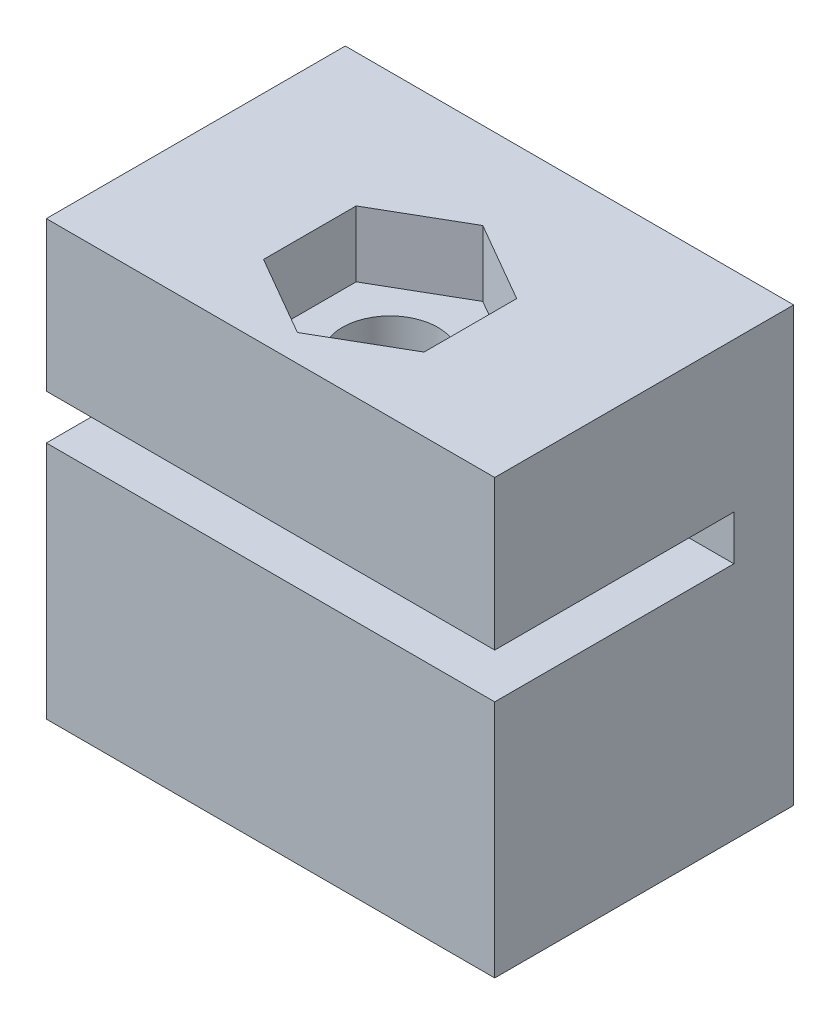
from build123d import *

# Parameters (mm, degrees)
SKETCH1_W    = 15
SKETCH1_H    = 10
BASE_DEPTH   = 8
SPACER_DEPTH = 1.5
SKETCH4_W    = 15
SKETCH4_H    = 10
TOP_DEPTH    = 5
SKETCH5_R    = 1.6
BORE_DEPTH   = 18.073371079
NUT_DEPTH    = 2.2


with BuildPart() as part:
    # Sketch1 → base (new body)
    with BuildSketch(Plane(origin=(0, 0, 0), x_dir=(1, 0, 0), z_dir=(0, 1, 0))):
        Rectangle(SKETCH1_W, SKETCH1_H)
    extrude(amount=BASE_DEPTH)

    # Sketch3 → spacer (add)
    with BuildSketch(Plane(origin=(0, 8, 0), x_dir=(1, 0, 0), z_dir=(0, 1, 0))):
        Polygon((-7.5, 3), (-5.99621099, 3), (5.99621099, 3), (7.5, 3), (7.5, 5), (-7.5, 5), align=None)
    extrude(amount=SPACER_DEPTH)

    # Sketch4 → top (add)
    with BuildSketch(Plane(origin=(0, 9.5, 0), x_dir=(1, 0, 0), z_dir=(0, 1, 0))):
        Rectangle(SKETCH4_W, SKETCH4_H)
    extrude(amount=TOP_DEPTH)

    # Sketch5 → bore (cut, through all)
    with BuildSketch(Plane(origin=(0, 14.5, 0), x_dir=(1, 0, 0), z_dir=(0, 1, 0))):
        with Locations(Location((0, -1, 0), (0, 0, 270))):
            Circle(SKETCH5_R)
    extrude(amount=-BORE_DEPTH, mode=Mode.SUBTRACT)

    # Sketch6 → nut (cut)
    with BuildSketch(Plane(origin=(0, 14.5, 0), x_dir=(1, 0, 0), z_dir=(0, 1, 0))):
        Polygon((0, -4.1), (2.684678752, -2.55), (2.684678752, 0.55), (0, 2.1), (-2.684678752, 0.55), (-2.684678752, -2.55), align=None)
    extrude(amount=-NUT_DEPTH, mode=Mode.SUBTRACT)


solid = part.part
